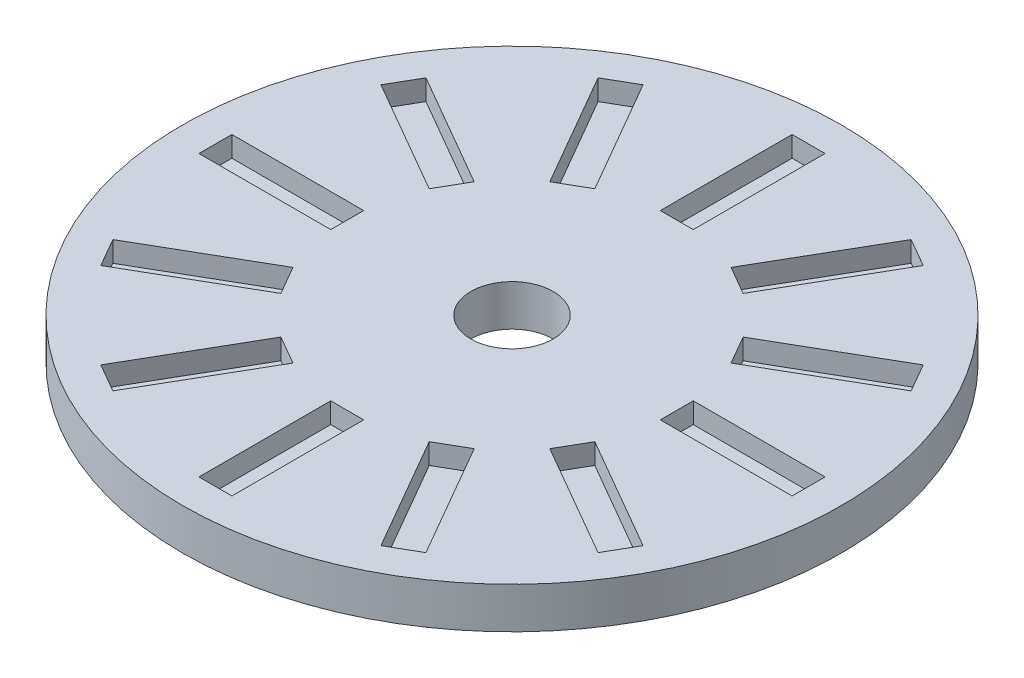
from build123d import *

# Parameters (mm, degrees)
SKETCH1_R               = 101.6
BOSS_EXTRUDE1_DEPTH     = 12.7
CUT_EXTRUDE1_DEPTH      = 6.35
CUT_EXTRUDE2_DEPTH      = 145.244271983
CUT_EXTRUDE2_DEPTH_BACK = 145.244271983
SKETCH3_R               = 12.7


with BuildPart() as part:
    # Sketch1 → Boss-Extrude1 (new body)
    with BuildSketch(Plane(origin=(0, 0, 0), x_dir=(1, 0, 0), z_dir=(0, 1, 0))):
        with Locations(Location((0, 0, 0), (0, 0, 270))):
            Circle(SKETCH1_R)
    extrude(amount=BOSS_EXTRUDE1_DEPTH)

    # Sketch2 → Cut-Extrude1 (cut)
    with BuildSketch(Plane(origin=(0, 12.7, 0), x_dir=(1, 0, 0), z_dir=(0, 1, 0))):
        Polygon((0, 50.8), (5.08, 50.8), (5.08, 91.44), (0, 91.44), (-5.08, 91.44), (-5.08, 50.8), align=None)
        Polygon((25.4, 43.994090512), (29.799409051, 41.454090512), (50.119409051, 76.649362922), (45.72, 79.189362922), (41.320590949, 81.729362922), (21.000590949, 46.534090512), align=None)
        Polygon((43.994090512, 25.4), (46.534090512, 21.000590949), (81.729362922, 41.320590949), (79.189362922, 45.72), (76.649362922, 50.119409051), (41.454090512, 29.799409051), align=None)
        Polygon((50.8, 0), (50.8, -5.08), (91.44, -5.08), (91.44, 0), (91.44, 5.08), (50.8, 5.08), align=None)
        Polygon((43.994090512, -25.4), (41.454090512, -29.799409051), (76.649362922, -50.119409051), (79.189362922, -45.72), (81.729362922, -41.320590949), (46.534090512, -21.000590949), align=None)
        Polygon((25.4, -43.994090512), (21.000590949, -46.534090512), (41.320590949, -81.729362922), (45.72, -79.189362922), (50.119409051, -76.649362922), (29.799409051, -41.454090512), align=None)
        Polygon((0, -50.8), (-5.08, -50.8), (-5.08, -91.44), (0, -91.44), (5.08, -91.44), (5.08, -50.8), align=None)
        Polygon((-25.4, -43.994090512), (-29.799409051, -41.454090512), (-50.119409051, -76.649362922), (-45.72, -79.189362922), (-41.320590949, -81.729362922), (-21.000590949, -46.534090512), align=None)
        Polygon((-43.994090512, -25.4), (-46.534090512, -21.000590949), (-81.729362922, -41.320590949), (-79.189362922, -45.72), (-76.649362922, -50.119409051), (-41.454090512, -29.799409051), align=None)
        Polygon((-50.8, 0), (-50.8, 5.08), (-91.44, 5.08), (-91.44, 0), (-91.44, -5.08), (-50.8, -5.08), align=None)
        Polygon((-43.994090512, 25.4), (-41.454090512, 29.799409051), (-76.649362922, 50.119409051), (-79.189362922, 45.72), (-81.729362922, 41.320590949), (-46.534090512, 21.000590949), align=None)
        Polygon((-25.4, 43.994090512), (-21.000590949, 46.534090512), (-41.320590949, 81.729362922), (-45.72, 79.189362922), (-50.119409051, 76.649362922), (-29.799409051, 41.454090512), align=None)
    extrude(amount=-CUT_EXTRUDE1_DEPTH, mode=Mode.SUBTRACT)

    # Sketch3 → Cut-Extrude2 (cut, two sides: drawn at the far end of the back side and taken through both)
    with BuildSketch(Plane(origin=(0, 12.7, 0), x_dir=(1, 0, 0), z_dir=(0, 1, 0)).offset(-CUT_EXTRUDE2_DEPTH_BACK)):
        with Locations(Location((0, 0, 0), (0, 0, 270))):
            Circle(SKETCH3_R)
    extrude(amount=CUT_EXTRUDE2_DEPTH + CUT_EXTRUDE2_DEPTH_BACK, mode=Mode.SUBTRACT)


solid = part.part
